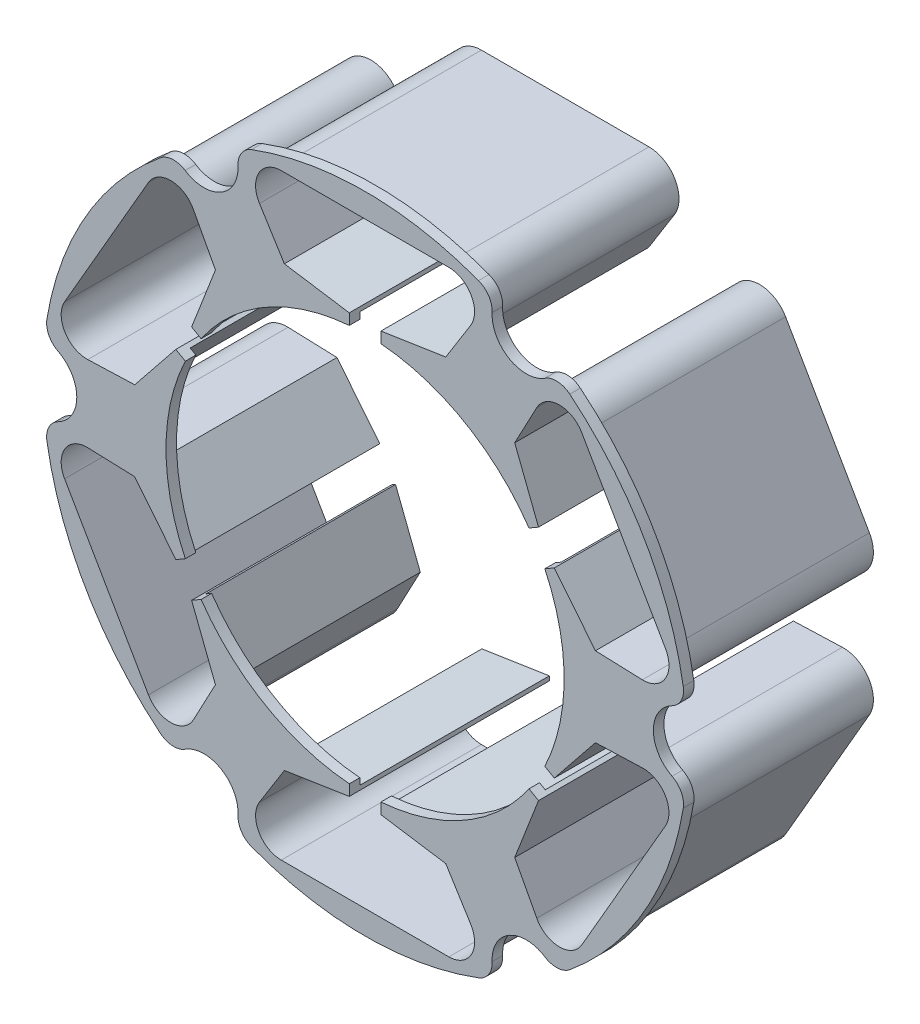
from build123d import *

# Parameters (mm, degrees)
Y_KSEKLIK_EKSTR_ZYON1_DEPTH   = 18
Y_KSEKLIK_EKSTR_ZYON1_2_DEPTH = 18
Y_KSEKLIK_EKSTR_ZYON1_3_DEPTH = 18
Y_KSEKLIK_EKSTR_ZYON1_4_DEPTH = 18
Y_KSEKLIK_EKSTR_ZYON1_5_DEPTH = 18
Y_KSEKLIK_EKSTR_ZYON1_6_DEPTH = 18
Y_KSEKLIK_EKSTR_ZYON2_DEPTH   = 1
RADYUS2_R                     = 2


with BuildPart() as part:
    # Çizim2 → Yükseklik-Ekstrüzyon1 (new body)
    with BuildSketch(Plane.XY):
        with BuildLine():
            Line((-1.5, 19.465437937), (-7.909238794, 20.451474675))
            Line((-7.909238794, 20.451474675), (-10.372800254, 24.393173012))
            ThreePointArc((-10.372800254, 24.393173012), (-10.44873616, 27.285260308), (-7.956005088, 28.753669991))
            Line((-7.956005088, 28.753669991), (7.956005088, 28.753669991))
            ThreePointArc((7.956005088, 28.753669991), (10.44873616, 27.285260308), (10.372800254, 24.393173012))
            Line((10.372800254, 24.393173012), (7.909238794, 20.451474675))
            Line((7.909238794, 20.451474675), (1.5, 19.465437937))
            Line((1.5, 19.465437937), (1.5, 19.880261633))
            Line((1.5, 19.880261633), (7.661158164, 20.828132119))
            Line((7.661158164, 20.828132119), (10.02512095, 24.610472577))
            ThreePointArc((10.02512095, 24.610472577), (10.090132742, 27.08650521), (7.956005088, 28.343669991))
            Line((7.956005088, 28.343669991), (-7.956005088, 28.343669991))
            ThreePointArc((-7.956005088, 28.343669991), (-10.090132742, 27.08650521), (-10.02512095, 24.610472577))
            Line((-10.02512095, 24.610472577), (-7.661158164, 20.828132119))
            Line((-7.661158164, 20.828132119), (-1.5, 19.880261633))
            Line((-1.5, 19.880261633), (-1.5, 19.465437937))
        make_face()
    extrude(amount=Y_KSEKLIK_EKSTR_ZYON1_DEPTH)



with BuildPart() as body_2:
    # Çizim2 → Y_kseklik-Ekstr_zyon1 2 (new body)
    with BuildSketch(Plane.XY):
        with BuildLine():
            Line((16.466811608, 11.239168922), (14.207112447, 17.048823652))
            Line((14.207112447, 17.048823652), (16.300733976, 20.987245707))
            ThreePointArc((16.300733976, 20.987245707), (18.41253524, 22.281563887), (20.568335704, 21.061937514))
            Line((20.568335704, 21.061937514), (28.524340792, 7.281732476))
            ThreePointArc((28.524340792, 7.281732476), (28.502667982, 4.804941323), (26.325854926, 3.62322687))
            Line((26.325854926, 3.62322687), (21.868270611, 3.779308467))
            Line((21.868270611, 3.779308467), (17.966811608, 8.641092711))
            Line((17.966811608, 8.641092711), (17.607563749, 8.433680863))
            Line((17.607563749, 8.433680863), (21.66611601, 3.376135617))
            Line((21.66611601, 3.376135617), (26.311507634, 3.213477977))
            ThreePointArc((26.311507634, 3.213477977), (28.854096655, 4.593759202), (28.879411208, 7.486732476))
            Line((28.879411208, 7.486732476), (20.92340612, 21.266937514))
            ThreePointArc((20.92340612, 21.266937514), (18.405360496, 22.691501106), (15.93870738, 21.179695034))
            Line((15.93870738, 21.179695034), (13.756877216, 17.075339057))
            Line((13.756877216, 17.075339057), (16.107563749, 11.031757074))
            Line((16.107563749, 11.031757074), (16.466811608, 11.239168922))
        make_face()
    extrude(amount=Y_KSEKLIK_EKSTR_ZYON1_2_DEPTH)


with BuildPart() as body_3:
    # Çizim2 → Y_kseklik-Ekstr_zyon1 3 (new body)
    with BuildSketch(Plane.XY):
        with BuildLine():
            Line((17.966811608, -8.641092711), (21.868270611, -3.779308467))
            Line((21.868270611, -3.779308467), (26.325854926, -3.62322687))
            ThreePointArc((26.325854926, -3.62322687), (28.502667982, -4.804941323), (28.524340792, -7.281732476))
            Line((28.524340792, -7.281732476), (20.568335704, -21.061937514))
            ThreePointArc((20.568335704, -21.061937514), (18.41253524, -22.281563887), (16.300733976, -20.987245707))
            Line((16.300733976, -20.987245707), (14.207112447, -17.048823652))
            Line((14.207112447, -17.048823652), (16.466811608, -11.239168922))
            Line((16.466811608, -11.239168922), (16.107563749, -11.031757074))
            Line((16.107563749, -11.031757074), (13.756877216, -17.075339057))
            Line((13.756877216, -17.075339057), (15.93870738, -21.179695034))
            ThreePointArc((15.93870738, -21.179695034), (18.405360496, -22.691501106), (20.92340612, -21.266937514))
            Line((20.92340612, -21.266937514), (28.879411208, -7.486732476))
            ThreePointArc((28.879411208, -7.486732476), (28.854096655, -4.593759202), (26.311507634, -3.213477977))
            Line((26.311507634, -3.213477977), (21.66611601, -3.376135617))
            Line((21.66611601, -3.376135617), (17.607563749, -8.433680863))
            Line((17.607563749, -8.433680863), (17.966811608, -8.641092711))
        make_face()
    extrude(amount=Y_KSEKLIK_EKSTR_ZYON1_3_DEPTH)


with BuildPart() as body_4:
    # Çizim2 → Y_kseklik-Ekstr_zyon1 4 (new body)
    with BuildSketch(Plane.XY):
        with BuildLine():
            Line((1.5, -19.880261633), (7.661158164, -20.828132119))
            Line((7.661158164, -20.828132119), (10.02512095, -24.610472577))
            ThreePointArc((10.02512095, -24.610472577), (10.090132742, -27.08650521), (7.956005088, -28.343669991))
            Line((7.956005088, -28.343669991), (-7.956005088, -28.343669991))
            ThreePointArc((-7.956005088, -28.343669991), (-10.090132742, -27.08650521), (-10.02512095, -24.610472577))
            Line((-10.02512095, -24.610472577), (-7.661158164, -20.828132119))
            Line((-7.661158164, -20.828132119), (-1.5, -19.880261633))
            Line((-1.5, -19.880261633), (-1.5, -19.465437937))
            Line((-1.5, -19.465437937), (-7.909238794, -20.451474675))
            Line((-7.909238794, -20.451474675), (-10.372800254, -24.393173012))
            ThreePointArc((-10.372800254, -24.393173012), (-10.44873616, -27.285260308), (-7.956005088, -28.753669991))
            Line((-7.956005088, -28.753669991), (7.956005088, -28.753669991))
            ThreePointArc((7.956005088, -28.753669991), (10.44873616, -27.285260308), (10.372800254, -24.393173012))
            Line((10.372800254, -24.393173012), (7.909238794, -20.451474675))
            Line((7.909238794, -20.451474675), (1.5, -19.465437937))
            Line((1.5, -19.465437937), (1.5, -19.880261633))
        make_face()
    extrude(amount=Y_KSEKLIK_EKSTR_ZYON1_4_DEPTH)


with BuildPart() as body_5:
    # Çizim2 → Y_kseklik-Ekstr_zyon1 5 (new body)
    with BuildSketch(Plane.XY):
        with BuildLine():
            Line((-16.466811608, -11.239168922), (-14.207112447, -17.048823652))
            Line((-14.207112447, -17.048823652), (-16.300733976, -20.987245707))
            ThreePointArc((-16.300733976, -20.987245707), (-18.41253524, -22.281563887), (-20.568335704, -21.061937514))
            Line((-20.568335704, -21.061937514), (-28.524340792, -7.281732476))
            ThreePointArc((-28.524340792, -7.281732476), (-28.502667982, -4.804941323), (-26.325854926, -3.62322687))
            Line((-26.325854926, -3.62322687), (-21.868270611, -3.779308467))
            Line((-21.868270611, -3.779308467), (-17.966811608, -8.641092711))
            Line((-17.966811608, -8.641092711), (-17.607563749, -8.433680863))
            Line((-17.607563749, -8.433680863), (-21.66611601, -3.376135617))
            Line((-21.66611601, -3.376135617), (-26.311507634, -3.213477977))
            ThreePointArc((-26.311507634, -3.213477977), (-28.854096655, -4.593759202), (-28.879411208, -7.486732476))
            Line((-28.879411208, -7.486732476), (-20.92340612, -21.266937514))
            ThreePointArc((-20.92340612, -21.266937514), (-18.405360496, -22.691501106), (-15.93870738, -21.179695034))
            Line((-15.93870738, -21.179695034), (-13.756877216, -17.075339057))
            Line((-13.756877216, -17.075339057), (-16.107563749, -11.031757074))
            Line((-16.107563749, -11.031757074), (-16.466811608, -11.239168922))
        make_face()
    extrude(amount=Y_KSEKLIK_EKSTR_ZYON1_5_DEPTH)


with BuildPart() as body_6:
    # Çizim2 → Y_kseklik-Ekstr_zyon1 6 (new body)
    with BuildSketch(Plane.XY):
        with BuildLine():
            Line((-17.966811608, 8.641092711), (-21.868270611, 3.779308467))
            Line((-21.868270611, 3.779308467), (-26.325854926, 3.62322687))
            ThreePointArc((-26.325854926, 3.62322687), (-28.502667982, 4.804941323), (-28.524340792, 7.281732476))
            Line((-28.524340792, 7.281732476), (-20.568335704, 21.061937514))
            ThreePointArc((-20.568335704, 21.061937514), (-18.41253524, 22.281563887), (-16.300733976, 20.987245707))
            Line((-16.300733976, 20.987245707), (-14.207112447, 17.048823652))
            Line((-14.207112447, 17.048823652), (-16.466811608, 11.239168922))
            Line((-16.466811608, 11.239168922), (-16.107563749, 11.031757074))
            Line((-16.107563749, 11.031757074), (-13.756877216, 17.075339057))
            Line((-13.756877216, 17.075339057), (-15.93870738, 21.179695034))
            ThreePointArc((-15.93870738, 21.179695034), (-18.405360496, 22.691501106), (-20.92340612, 21.266937514))
            Line((-20.92340612, 21.266937514), (-28.879411208, 7.486732476))
            ThreePointArc((-28.879411208, 7.486732476), (-28.854096655, 4.593759202), (-26.311507634, 3.213477977))
            Line((-26.311507634, 3.213477977), (-21.66611601, 3.376135617))
            Line((-21.66611601, 3.376135617), (-17.607563749, 8.433680863))
            Line((-17.607563749, 8.433680863), (-17.966811608, 8.641092711))
        make_face()
    extrude(amount=Y_KSEKLIK_EKSTR_ZYON1_6_DEPTH)


with BuildPart() as part_1:
    add(part.part)

    add(body_2.part)  # Yükseklik-Ekstrüzyon2 merges body 2

    add(body_3.part)  # Yükseklik-Ekstrüzyon2 merges body 3

    add(body_4.part)  # Yükseklik-Ekstrüzyon2 merges body 4

    add(body_5.part)  # Yükseklik-Ekstrüzyon2 merges body 5

    add(body_6.part)  # Yükseklik-Ekstrüzyon2 merges body 6
    # Çizim3 → Yükseklik-Ekstrüzyon2 (add)
    with BuildSketch(Plane.XY.offset(18)):
        with BuildLine():
            ThreePointArc((-18.034377684, 24.745618229), (-26.517697864, 15.31), (-30.447522861, 3.245420102))
            ThreePointArc((-30.447522861, 3.245420102), (-27.37, 0), (-30.447522861, -3.245420102))
            ThreePointArc((-30.447522861, -3.245420102), (-26.517697864, -15.31), (-18.034377684, -24.745618229))
            ThreePointArc((-18.034377684, -24.745618229), (-13.685, -23.703115302), (-12.413145176, -27.991038331))
            ThreePointArc((-12.413145176, -27.991038331), (0, -30.62), (12.413145176, -27.991038331))
            ThreePointArc((12.413145176, -27.991038331), (13.685, -23.703115302), (18.034377684, -24.745618229))
            ThreePointArc((18.034377684, -24.745618229), (26.517697864, -15.31), (30.447522861, -3.245420102))
            ThreePointArc((30.447522861, -3.245420102), (27.37, 0), (30.447522861, 3.245420102))
            ThreePointArc((30.447522861, 3.245420102), (26.517697864, 15.31), (18.034377684, 24.745618229))
            ThreePointArc((18.034377684, 24.745618229), (13.685, 23.703115302), (12.413145176, 27.991038331))
            ThreePointArc((12.413145176, 27.991038331), (0, 30.62), (-12.413145176, 27.991038331))
            ThreePointArc((-12.413145176, 27.991038331), (-13.685, 23.703115302), (-18.034377684, 24.745618229))
        make_face()
        with BuildLine():
            Line((10.02512095, 24.610472577), (7.661158164, 20.828132119))
            Line((7.661158164, 20.828132119), (1.5, 19.880261633))
            Line((1.5, 19.880261633), (1.5, 18.840382162))
            ThreePointArc((1.5, 18.840382162), (9.45, 16.367880132), (15.566249569, 10.719229187))
            Line((15.566249569, 10.719229187), (16.466811608, 11.239168922))
            Line((16.466811608, 11.239168922), (14.207112447, 17.048823652))
            Line((14.207112447, 17.048823652), (16.300733976, 20.987245707))
            ThreePointArc((16.300733976, 20.987245707), (18.41253524, 22.281563887), (20.568335704, 21.061937514))
            Line((20.568335704, 21.061937514), (28.524340792, 7.281732476))
            ThreePointArc((28.524340792, 7.281732476), (28.502667982, 4.804941323), (26.325854926, 3.62322687))
            Line((26.325854926, 3.62322687), (21.868270611, 3.779308467))
            Line((21.868270611, 3.779308467), (17.966811608, 8.641092711))
            Line((17.966811608, 8.641092711), (17.066249569, 8.121152975))
            ThreePointArc((17.066249569, 8.121152975), (18.9, 0), (17.066249569, -8.121152975))
            Line((17.066249569, -8.121152975), (17.966811608, -8.641092711))
            Line((17.966811608, -8.641092711), (21.868270611, -3.779308467))
            Line((21.868270611, -3.779308467), (26.325854926, -3.62322687))
            ThreePointArc((26.325854926, -3.62322687), (28.502667982, -4.804941323), (28.524340792, -7.281732476))
            Line((28.524340792, -7.281732476), (20.568335704, -21.061937514))
            ThreePointArc((20.568335704, -21.061937514), (18.41253524, -22.281563887), (16.300733976, -20.987245707))
            Line((16.300733976, -20.987245707), (14.207112447, -17.048823652))
            Line((14.207112447, -17.048823652), (16.466811608, -11.239168922))
            Line((16.466811608, -11.239168922), (15.566249569, -10.719229187))
            ThreePointArc((15.566249569, -10.719229187), (9.45, -16.367880132), (1.5, -18.840382162))
            Line((1.5, -18.840382162), (1.5, -19.880261633))
            Line((1.5, -19.880261633), (7.661158164, -20.828132119))
            Line((7.661158164, -20.828132119), (10.02512095, -24.610472577))
            ThreePointArc((10.02512095, -24.610472577), (10.090132742, -27.08650521), (7.956005088, -28.343669991))
            Line((7.956005088, -28.343669991), (-7.956005088, -28.343669991))
            ThreePointArc((-7.956005088, -28.343669991), (-10.090132742, -27.08650521), (-10.02512095, -24.610472577))
            Line((-10.02512095, -24.610472577), (-7.661158164, -20.828132119))
            Line((-7.661158164, -20.828132119), (-1.5, -19.880261633))
            Line((-1.5, -19.880261633), (-1.5, -18.840382162))
            ThreePointArc((-1.5, -18.840382162), (-9.45, -16.367880132), (-15.566249569, -10.719229187))
            Line((-15.566249569, -10.719229187), (-16.466811608, -11.239168922))
            Line((-16.466811608, -11.239168922), (-14.207112447, -17.048823652))
            Line((-14.207112447, -17.048823652), (-16.300733976, -20.987245707))
            ThreePointArc((-16.300733976, -20.987245707), (-18.41253524, -22.281563887), (-20.568335704, -21.061937514))
            Line((-20.568335704, -21.061937514), (-28.524340792, -7.281732476))
            ThreePointArc((-28.524340792, -7.281732476), (-28.502667982, -4.804941323), (-26.325854926, -3.62322687))
            Line((-26.325854926, -3.62322687), (-21.868270611, -3.779308467))
            Line((-21.868270611, -3.779308467), (-17.966811608, -8.641092711))
            Line((-17.966811608, -8.641092711), (-17.066249569, -8.121152975))
            ThreePointArc((-17.066249569, -8.121152975), (-18.9, 0), (-17.066249569, 8.121152975))
            Line((-17.066249569, 8.121152975), (-17.966811608, 8.641092711))
            Line((-17.966811608, 8.641092711), (-21.868270611, 3.779308467))
            Line((-21.868270611, 3.779308467), (-26.325854926, 3.62322687))
            ThreePointArc((-26.325854926, 3.62322687), (-28.502667982, 4.804941323), (-28.524340792, 7.281732476))
            Line((-28.524340792, 7.281732476), (-20.568335704, 21.061937514))
            ThreePointArc((-20.568335704, 21.061937514), (-18.41253524, 22.281563887), (-16.300733976, 20.987245707))
            Line((-16.300733976, 20.987245707), (-14.207112447, 17.048823652))
            Line((-14.207112447, 17.048823652), (-16.466811608, 11.239168922))
            Line((-16.466811608, 11.239168922), (-15.566249569, 10.719229187))
            ThreePointArc((-15.566249569, 10.719229187), (-9.45, 16.367880132), (-1.5, 18.840382162))
            Line((-1.5, 18.840382162), (-1.5, 19.880261633))
            Line((-1.5, 19.880261633), (-7.661158164, 20.828132119))
            Line((-7.661158164, 20.828132119), (-10.02512095, 24.610472577))
            ThreePointArc((-10.02512095, 24.610472577), (-10.090132742, 27.08650521), (-7.956005088, 28.343669991))
            Line((-7.956005088, 28.343669991), (7.956005088, 28.343669991))
            ThreePointArc((7.956005088, 28.343669991), (10.090132742, 27.08650521), (10.02512095, 24.610472577))
        make_face(mode=Mode.SUBTRACT)
    extrude(amount=Y_KSEKLIK_EKSTR_ZYON2_DEPTH)

    # Radyus2
    radyus2_edges = [part_1.edges().sort_by_distance(p)[0] for p in [
        (12.413145176, 27.991038331, 18.5),
        (-12.413145176, 27.991038331, 18.5),
        (-18.034377684, 24.745618229, 18.5),
        (-30.447522861, 3.245420102, 18.5),
        (-30.447522861, -3.245420102, 18.5),
        (-18.034377684, -24.745618229, 18.5),
        (-12.413145176, -27.991038331, 18.5),
        (12.413145176, -27.991038331, 18.5),
        (18.034377684, -24.745618229, 18.5),
        (30.447522861, -3.245420102, 18.5),
        (30.447522861, 3.245420102, 18.5),
        (18.034377684, 24.745618229, 18.5),
    ]]
    fillet(radyus2_edges, radius=RADYUS2_R)


solid = part_1.part
